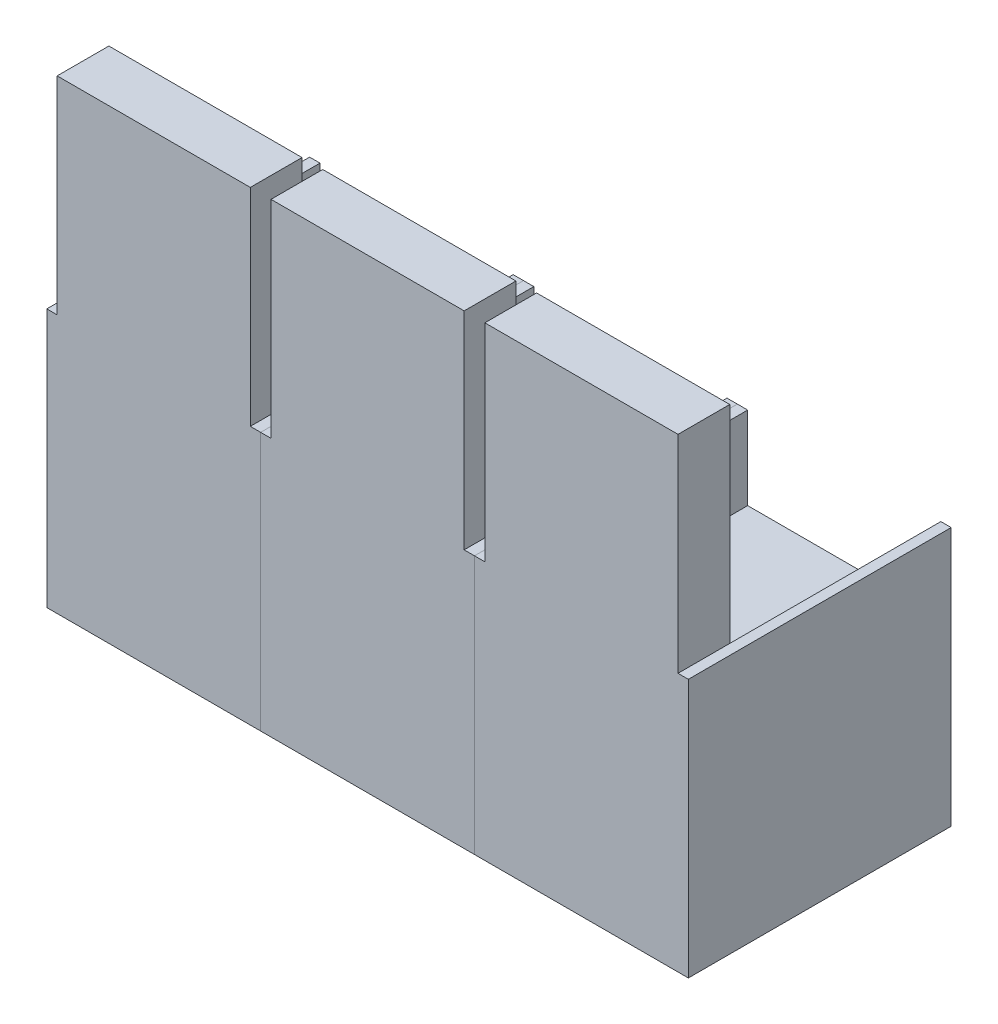
from build123d import *

# Parameters (mm, degrees)
SKETCH1_W           = 524.933333333
SKETCH1_H           = 645.16
BOSS_EXTRUDE1_DEPTH = 431.8
SKETCH2_W           = 25.4
SKETCH2_H           = 645.16
BOSS_EXTRUDE2_DEPTH = 203.2
SKETCH3_W           = 474.133333333
SKETCH3_H           = 127
BOSS_EXTRUDE3_DEPTH = 711.2
LPATTERN1_COUNT     = 3
LPATTERN1_PITCH     = 524.933333333


with BuildPart() as part:
    # Sketch1 → Boss-Extrude1 (new body)
    with BuildSketch(Plane(origin=(0, 0, 0), x_dir=(1, 0, 0), z_dir=(0, 1, 0))):
        with Locations((-133.337281832, -322.58)):
            Rectangle(SKETCH1_W, SKETCH1_H)
    extrude(amount=BOSS_EXTRUDE1_DEPTH)

    # Sketch2 → Boss-Extrude2 (add)
    with BuildSketch(Plane(origin=(0, 431.8, 0), x_dir=(1, 0, 0), z_dir=(0, 1, 0))):
        with Locations((-383.103948498, -322.58)):
            Rectangle(SKETCH2_W, SKETCH2_H)
        with Locations((116.429384835, -322.58)):
            Rectangle(SKETCH2_W, SKETCH2_H)
    extrude(amount=BOSS_EXTRUDE2_DEPTH)

    # Sketch3 → Boss-Extrude3 (add)
    with BuildSketch(Plane(origin=(0, 431.8, 0), x_dir=(1, 0, 0), z_dir=(0, 1, 0))):
        with Locations((-133.337281832, -581.66)):
            Rectangle(SKETCH3_W, SKETCH3_H)
    extrude(amount=BOSS_EXTRUDE3_DEPTH)


with BuildPart() as lpattern1_1:
    # LPattern1: pattern copy
    add(part.part.moved(Location(Vector(1, 0, 0) * (1 * LPATTERN1_PITCH))))


with BuildPart() as lpattern1_2:
    # LPattern1: pattern copy
    add(part.part.moved(Location(Vector(1, 0, 0) * (2 * LPATTERN1_PITCH))))


solid = Compound([part.part, lpattern1_1.part, lpattern1_2.part])
